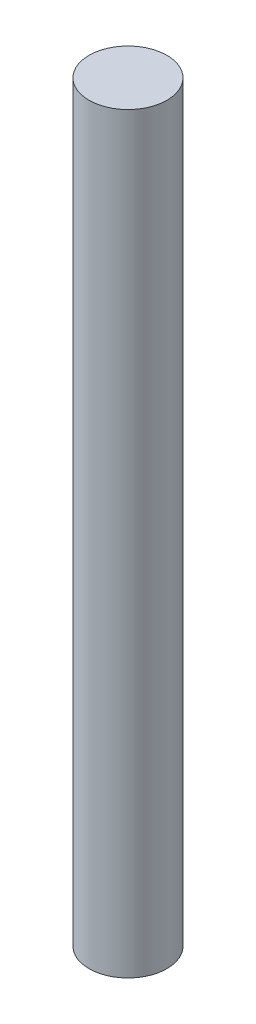
from build123d import *

# Parameters (mm, degrees)
SKETCH1_R           = 0.95
BOSS_EXTRUDE1_DEPTH = 18.35


with BuildPart() as part:
    # Sketch1 → Boss-Extrude1 (new body)
    with BuildSketch(Plane(origin=(0, 0, 0), x_dir=(1, 0, 0), z_dir=(0, 1, 0))):
        with Locations(Location((0, 0, 0), (0, 0, 270))):
            Circle(SKETCH1_R)
    extrude(amount=BOSS_EXTRUDE1_DEPTH)


solid = part.part
